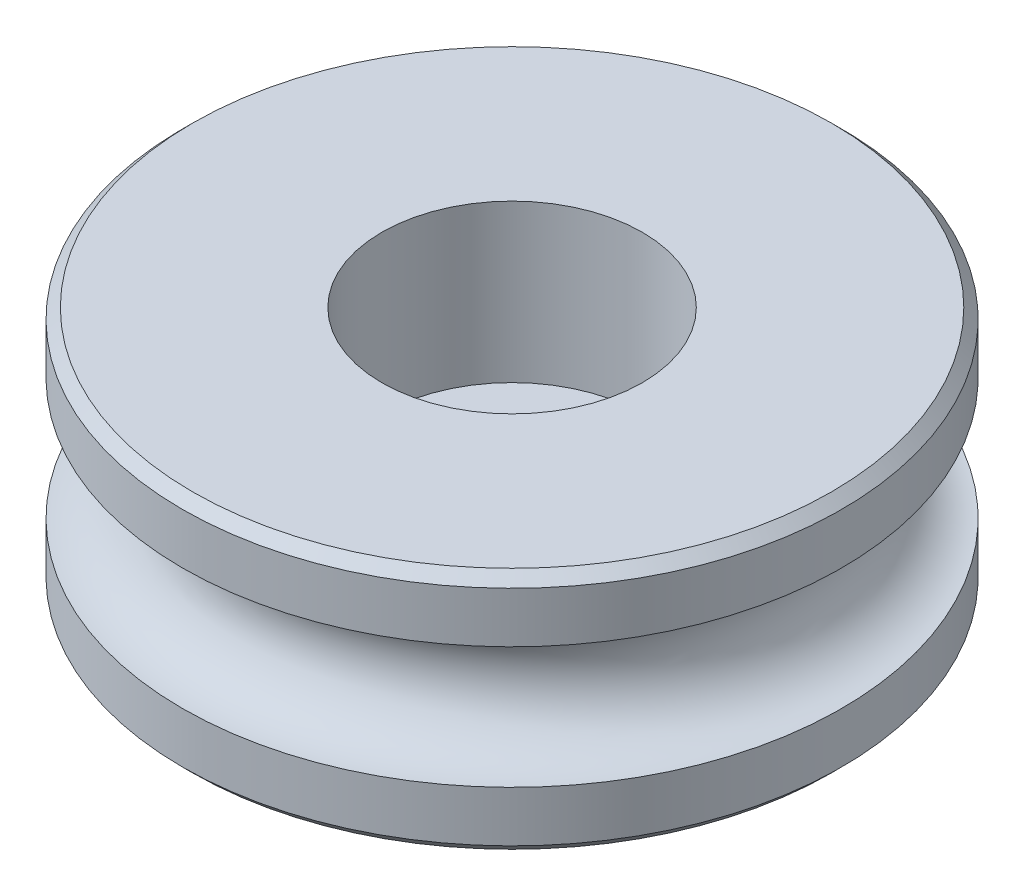
from build123d import *


with BuildPart() as part:
    # Sketch1 → Revolve1 (revolve)
    with BuildSketch(Plane.XY, mode=Mode.PRIVATE) as revolve1_sk:
        with BuildLine():
            Line((7, 0), (31.5, 0))
            Line((31.5, 0), (32.5, 1))
            Line((32.5, 1), (32.5, 6))
            ThreePointArc((32.5, 6), (26.5, 12), (32.5, 18))
            Line((32.5, 18), (32.5, 23))
            Line((32.5, 23), (31.5, 24))
            Line((31.5, 24), (12.85, 24))
            Line((12.85, 24), (12.85, 8.5))
            Line((12.85, 8.5), (7, 8.5))
            Line((7, 8.5), (7, 0))
        make_face()
    revolve(revolve1_sk.sketch.rotate(Axis((0, 24, 0), (0, -1, 0)), 90), axis=Axis((0, 24, 0), (0, -1, 0)))


solid = part.part
